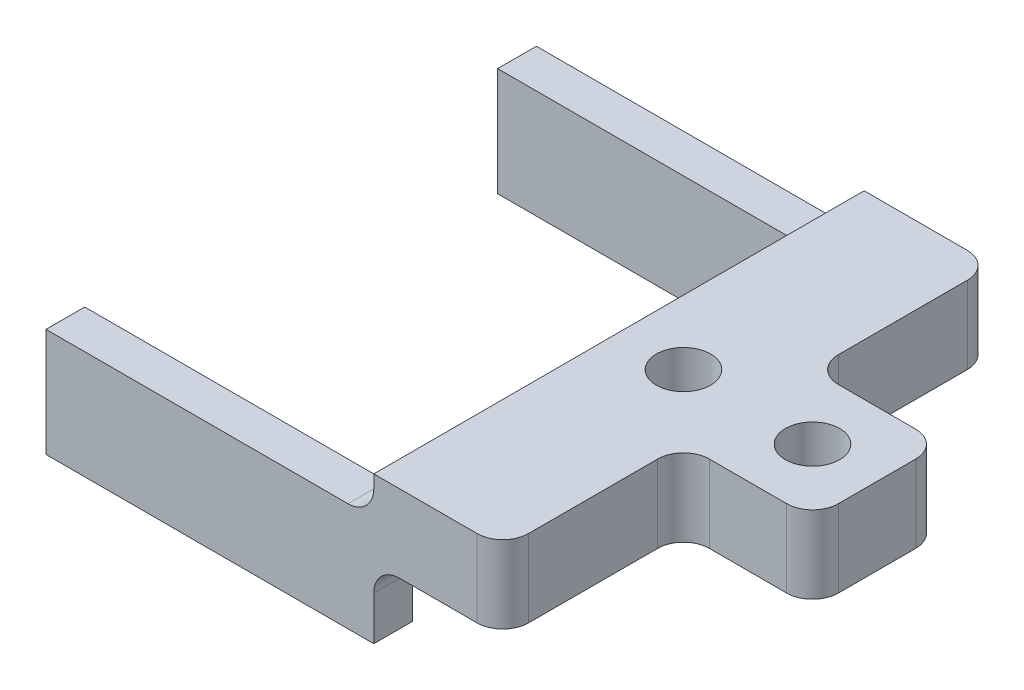
from build123d import *

# Parameters (mm, degrees)
SKETCH_1_W           = 25.4
SKETCH_1_H           = 3
EXTRUDE_1_DEPTH      = 8.4
EXTRUDE_1_2_DEPTH    = 8.4
EXTRUDE_2_DEPTH      = 3
EXTRUDE_2_DEPTH_BACK = 3
FILLET_1_R           = 2
SKETCH_3_R           = 2.1
CUT_EXTRUDE_1_DEPTH  = 6


with BuildPart() as part:
    # 草图1 → 凸台-拉伸1 (new body)
    with BuildSketch(Plane(origin=(0, 0, 0), x_dir=(1, 0, 0), z_dir=(0, 1, 0))):
        with Locations((-63.521674557, 78.184540652)):
            Rectangle(SKETCH_1_W, SKETCH_1_H)
    extrude(amount=EXTRUDE_1_DEPTH)



with BuildPart() as body_2:
    # 草图1 → Extrude 1 2 (new body)
    with BuildSketch(Plane(origin=(0, 0, 0), x_dir=(1, 0, 0), z_dir=(0, 1, 0))):
        with Locations((-63.521674557, 43.184540652)):
            Rectangle(SKETCH_1_W, SKETCH_1_H)
    extrude(amount=EXTRUDE_1_2_DEPTH)


with BuildPart() as part_1:
    add(part.part)

    add(body_2.part)  # 凸台-拉伸2 merges body 2
    # 草图2 → 凸台-拉伸2 (add, two sides: drawn at the far end of the back side and taken through both)
    with BuildSketch(Plane(origin=(0, 8.4, 0), x_dir=(1, 0, 0), z_dir=(0, 1, 0)).offset(-EXTRUDE_2_DEPTH_BACK)):
        Polygon((-40.821674557, 55.684540652), (-40.821674557, 41.684540652), (-50.821674557, 41.684540652), (-50.821674557, 79.684540652), (-40.821674557, 79.684540652), (-40.821674557, 65.684540652), (-30.821674557, 65.684540652), (-30.821674557, 55.684540652), align=None)
    extrude(amount=EXTRUDE_2_DEPTH + EXTRUDE_2_DEPTH_BACK)

    # 圆角1
    fillet_1_edges = [part_1.edges().sort_by_distance(p)[0] for p in [
        (-50.821674557, 8.4, -78.184540652),
        (-50.821674557, 5.4, -78.184540652),
        (-40.821674557, 8.4, -79.684540652),
        (-40.821674557, 8.4, -65.684540652),
        (-30.821674557, 8.4, -65.684540652),
        (-30.821674557, 8.4, -55.684540652),
        (-40.821674557, 8.4, -55.684540652),
        (-40.821674557, 8.4, -41.684540652),
        (-50.821674557, 5.4, -43.184540652),
        (-50.821674557, 8.4, -43.184540652),
    ]]
    fillet(fillet_1_edges, radius=FILLET_1_R)

    # 草图3 → 切除-拉伸1 (cut)
    with BuildSketch(Plane(origin=(0, 11.4, 0), x_dir=(1, 0, 0), z_dir=(0, 1, 0))):
        with Locations(Location((-45.821674557, 60.684540652, 0), (0, 0, 270))):
            Circle(SKETCH_3_R)
        with Locations(Location((-35.821674557, 60.684540652, 0), (0, 0, 270))):
            Circle(SKETCH_3_R)
    extrude(amount=-CUT_EXTRUDE_1_DEPTH, mode=Mode.SUBTRACT)


solid = part_1.part
